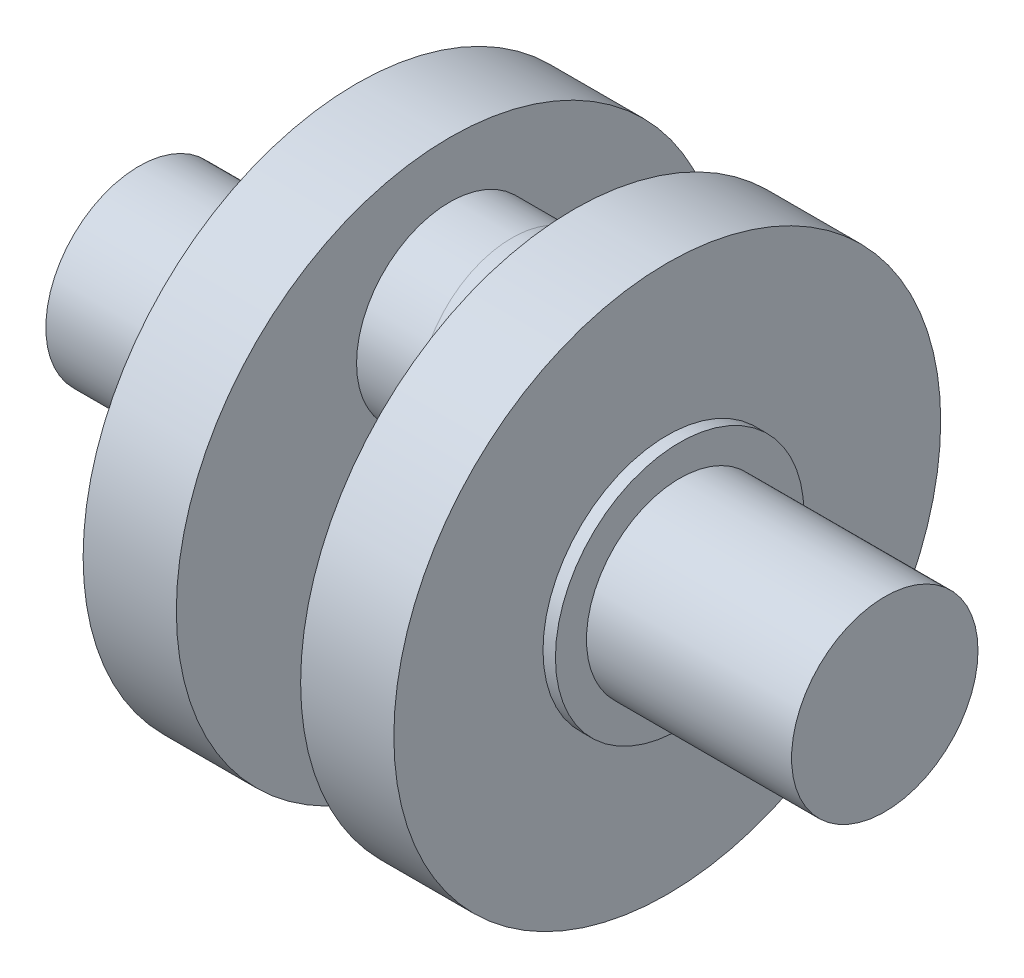
from build123d import *

# Parameters (mm, degrees)
SZKIC1_R                    = 15
DODANIE_WYCI_GNI_CIE1_DEPTH = 33
SZKIC4_R                    = 20
DODANIE_WYCI_GNI_CIE2_DEPTH = 2
SZKIC6_R                    = 44
DODANIE_WYCI_GNI_CIE4_DEPTH = 15
SZKIC7_R                    = 15
DODANIE_WYCI_GNI_CIE5_DEPTH = 10


with BuildPart() as part:
    # Szkic1 → Dodanie-wyciągnięcie1 (new body)
    with BuildSketch(Plane(origin=(0, 0, 0), x_dir=(0, 0, -1), z_dir=(1, 0, 0))):
        Circle(SZKIC1_R)
    extrude(amount=DODANIE_WYCI_GNI_CIE1_DEPTH)

    # Szkic4 → Dodanie-wyciągnięcie2 (add)
    with BuildSketch(Plane(origin=(0, 0, 0), x_dir=(0, 0, -1), z_dir=(1, 0, 0))):
        Circle(SZKIC4_R)
    extrude(amount=-DODANIE_WYCI_GNI_CIE2_DEPTH)

    # Szkic6 → Dodanie-wyciągnięcie4 (add)
    with BuildSketch(Plane.ZY.offset(2)):
        Circle(SZKIC6_R)
    extrude(amount=DODANIE_WYCI_GNI_CIE4_DEPTH)

    # Szkic7 → Dodanie-wyciągnięcie5 (add)
    with BuildSketch(Plane.ZY.offset(17)):
        with Locations((0, 20)):
            Circle(SZKIC7_R)
    extrude(amount=DODANIE_WYCI_GNI_CIE5_DEPTH)


with BuildPart() as body_2:
    # Lustro1: mirrored copy
    add(part.part.mirror(Plane(origin=(-27, 20, 0), x_dir=(0, 0, 1), z_dir=(-1, 0, 0))))


solid = Compound([part.part, body_2.part])
